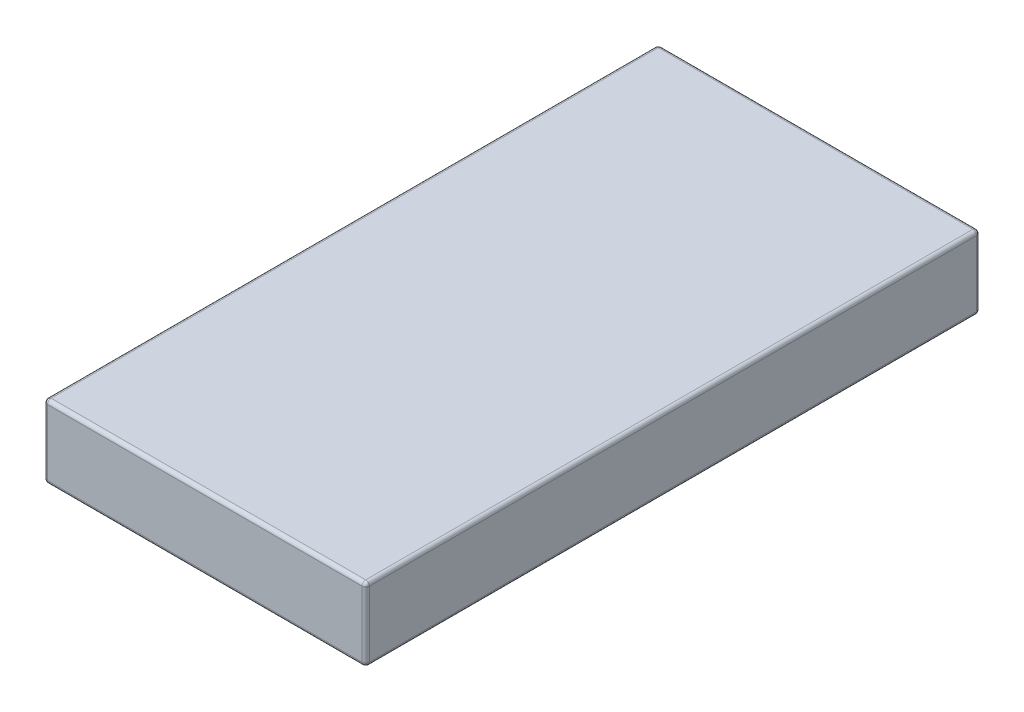
from build123d import *

# Parameters (mm, degrees)
CROQUIS1_W              = 44
CROQUIS1_H              = 84
SALIENTE_EXTRUIR1_DEPTH = 10
REDONDEO2_R             = 0.5


with BuildPart() as part:
    # Croquis1 → Saliente-Extruir1 (new body)
    with BuildSketch(Plane(origin=(0, 0, 0), x_dir=(1, 0, 0), z_dir=(0, 1, 0))):
        with Locations((22, 42)):
            Rectangle(CROQUIS1_W, CROQUIS1_H)
    extrude(amount=SALIENTE_EXTRUIR1_DEPTH)

    # Redondeo2
    redondeo2_edges = [part.edges().sort_by_distance(p)[0] for p in [
        (44, 10, -42),
        (22, 10, -84),
        (0, 10, -42),
        (22, 0, -84),
        (44, 0, -42),
        (22, 0, 0),
        (0, 0, -42),
        (0, 5, -84),
        (44, 5, -84),
        (44, 5, 0),
        (0, 5, 0),
        (22, 10, 0),
    ]]
    fillet(redondeo2_edges, radius=REDONDEO2_R)


solid = part.part
